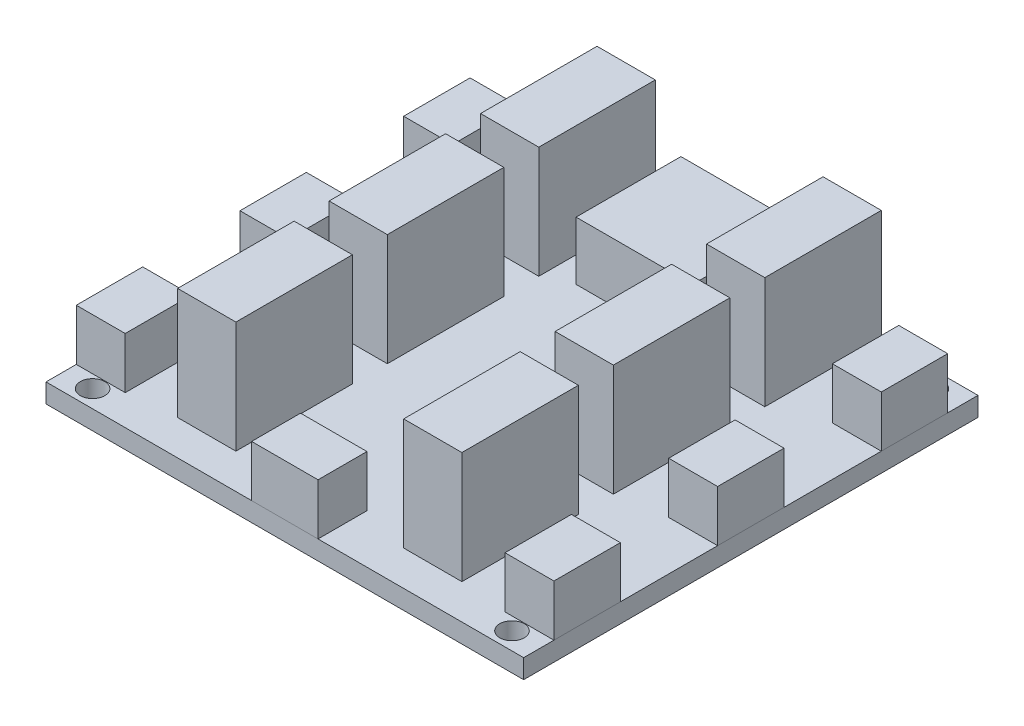
from build123d import *

# Parameters (mm, degrees)
SKETCH_1_W        = 41
SKETCH_1_H        = 39
SKETCH_1_R        = 1.05
EXTRUDE_437_DEPTH = 1.64
SKETCH_3_W        = 10
SKETCH_3_H        = 9
XT30_DEPTH        = 5
SKETCH_4_W        = 4.2
SKETCH_4_H        = 5.7
CAN_DEPTH         = 4.4
CAN_2_DEPTH       = 4.4
CAN_3_DEPTH       = 4.4
CAN_4_DEPTH       = 4.4
CAN_5_DEPTH       = 4.4
CAN_6_DEPTH       = 4.4
SKETCH_4_W_2      = 5.7
SKETCH_4_H_2      = 4.2
CAN_7_DEPTH       = 4.4
SKETCH_5_W        = 5
SKETCH_5_H        = 10
XT30_2_DEPTH      = 9.6
XT30_2_2_DEPTH    = 9.6
XT30_2_3_DEPTH    = 9.6
XT30_2_4_DEPTH    = 9.6
XT30_2_5_DEPTH    = 9.6
XT30_2_6_DEPTH    = 9.6


with BuildPart() as part:
    # 草图1 → Extrude 437 (new body)
    with BuildSketch(Plane(origin=(0, 0, 0), x_dir=(1, 0, 0), z_dir=(0, 1, 0))):
        Rectangle(SKETCH_1_W, SKETCH_1_H)
        with Locations(Location((18, 18, 0), (0, 0, 270))):
            Circle(SKETCH_1_R, mode=Mode.SUBTRACT)
        with Locations(Location((-18, 18, 0), (0, 0, 270))):
            Circle(SKETCH_1_R, mode=Mode.SUBTRACT)
        with Locations(Location((-18, -18, 0), (0, 0, 270))):
            Circle(SKETCH_1_R, mode=Mode.SUBTRACT)
        with Locations(Location((18, -18, 0), (0, 0, 270))):
            Circle(SKETCH_1_R, mode=Mode.SUBTRACT)
    extrude(amount=EXTRUDE_437_DEPTH)


with BuildPart() as body_2:
    # 草图3 → xt30 (new body)
    with BuildSketch(Plane(origin=(0, 1.64, 0), x_dir=(1, 0, 0), z_dir=(0, 1, 0))):
        with Locations((0, 15)):
            Rectangle(SKETCH_3_W, SKETCH_3_H)
    extrude(amount=XT30_DEPTH)


with BuildPart() as body_3:
    # 草图4 → can (new body)
    with BuildSketch(Plane(origin=(0, 1.64, 0), x_dir=(1, 0, 0), z_dir=(0, 1, 0))):
        with Locations((18.4, 14.05)):
            Rectangle(SKETCH_4_W, SKETCH_4_H)
    extrude(amount=CAN_DEPTH)


with BuildPart() as body_4:
    # 草图4 → can 2 (new body)
    with BuildSketch(Plane(origin=(0, 1.64, 0), x_dir=(1, 0, 0), z_dir=(0, 1, 0))):
        with Locations((18.4, 0)):
            Rectangle(SKETCH_4_W, SKETCH_4_H)
    extrude(amount=CAN_2_DEPTH)


with BuildPart() as body_5:
    # 草图4 → can 3 (new body)
    with BuildSketch(Plane(origin=(0, 1.64, 0), x_dir=(1, 0, 0), z_dir=(0, 1, 0))):
        with Locations((18.4, -14.05)):
            Rectangle(SKETCH_4_W, SKETCH_4_H)
    extrude(amount=CAN_3_DEPTH)


with BuildPart() as body_6:
    # 草图4 → can 4 (new body)
    with BuildSketch(Plane(origin=(0, 1.64, 0), x_dir=(1, 0, 0), z_dir=(0, 1, 0))):
        with Locations((-18.4, -14.05)):
            Rectangle(SKETCH_4_W, SKETCH_4_H)
    extrude(amount=CAN_4_DEPTH)


with BuildPart() as body_7:
    # 草图4 → can 5 (new body)
    with BuildSketch(Plane(origin=(0, 1.64, 0), x_dir=(1, 0, 0), z_dir=(0, 1, 0))):
        with Locations((-18.4, 0)):
            Rectangle(SKETCH_4_W, SKETCH_4_H)
    extrude(amount=CAN_5_DEPTH)


with BuildPart() as body_8:
    # 草图4 → can 6 (new body)
    with BuildSketch(Plane(origin=(0, 1.64, 0), x_dir=(1, 0, 0), z_dir=(0, 1, 0))):
        with Locations((-18.4, 14.05)):
            Rectangle(SKETCH_4_W, SKETCH_4_H)
    extrude(amount=CAN_6_DEPTH)


with BuildPart() as body_9:
    # 草图4 → can 7 (new body)
    with BuildSketch(Plane(origin=(0, 1.64, 0), x_dir=(1, 0, 0), z_dir=(0, 1, 0))):
        with Locations((0, -17.4)):
            Rectangle(SKETCH_4_W_2, SKETCH_4_H_2)
    extrude(amount=CAN_7_DEPTH)


with BuildPart() as body_10:
    # 草图5 → xt30 2 (new body)
    with BuildSketch(Plane(origin=(0, 1.64, 0), x_dir=(1, 0, 0), z_dir=(0, 1, 0))):
        with Locations((-9.7, 14.5)):
            Rectangle(SKETCH_5_W, SKETCH_5_H)
    extrude(amount=XT30_2_DEPTH)


with BuildPart() as body_11:
    # 草图5 → xt30 2 2 (new body)
    with BuildSketch(Plane(origin=(0, 1.64, 0), x_dir=(1, 0, 0), z_dir=(0, 1, 0))):
        with Locations((-9.7, 1.5)):
            Rectangle(SKETCH_5_W, SKETCH_5_H)
    extrude(amount=XT30_2_2_DEPTH)


with BuildPart() as body_12:
    # 草图5 → xt30 2 3 (new body)
    with BuildSketch(Plane(origin=(0, 1.64, 0), x_dir=(1, 0, 0), z_dir=(0, 1, 0))):
        with Locations((-9.7, -11.5)):
            Rectangle(SKETCH_5_W, SKETCH_5_H)
    extrude(amount=XT30_2_3_DEPTH)


with BuildPart() as body_13:
    # 草图5 → xt30 2 4 (new body)
    with BuildSketch(Plane(origin=(0, 1.64, 0), x_dir=(1, 0, 0), z_dir=(0, 1, 0))):
        with Locations((9.7, -11.5)):
            Rectangle(SKETCH_5_W, SKETCH_5_H)
    extrude(amount=XT30_2_4_DEPTH)


with BuildPart() as body_14:
    # 草图5 → xt30 2 5 (new body)
    with BuildSketch(Plane(origin=(0, 1.64, 0), x_dir=(1, 0, 0), z_dir=(0, 1, 0))):
        with Locations((9.7, 1.5)):
            Rectangle(SKETCH_5_W, SKETCH_5_H)
    extrude(amount=XT30_2_5_DEPTH)


with BuildPart() as body_15:
    # 草图5 → xt30 2 6 (new body)
    with BuildSketch(Plane(origin=(0, 1.64, 0), x_dir=(1, 0, 0), z_dir=(0, 1, 0))):
        with Locations((9.7, 14.5)):
            Rectangle(SKETCH_5_W, SKETCH_5_H)
    extrude(amount=XT30_2_6_DEPTH)


solid = Compound([part.part, body_2.part, body_3.part, body_4.part, body_5.part, body_6.part, body_7.part, body_8.part, body_9.part, body_10.part, body_11.part, body_12.part, body_13.part, body_14.part, body_15.part])
